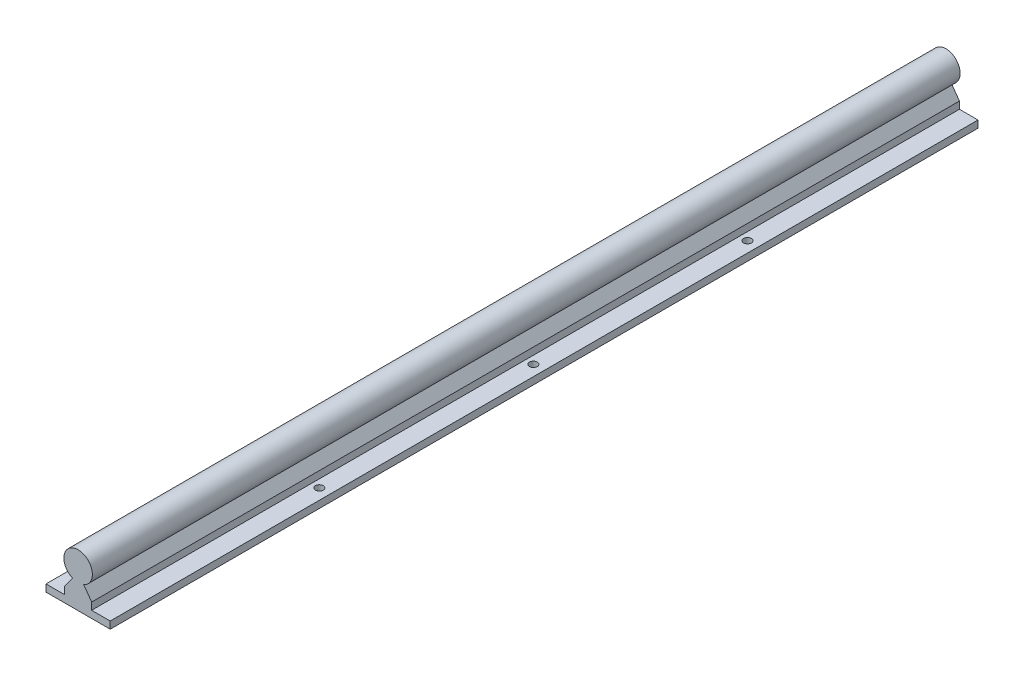
from build123d import *

# Parameters (mm, degrees)
SKETCH_1_R          = 10
EXTRUDE_1_DEPTH     = 608
SKETCH_2_R          = 2.75
CUT_EXTRUDE_2_DEPTH = 450


with BuildPart() as part:
    # 草图1 → 凸台-拉伸1 (new body)
    with BuildSketch(Plane.XY):
        with Locations((0, 27)):
            Circle(SKETCH_1_R)
        with BuildLine():
            Line((-22.5, 5), (-22.5, 0))
            Line((-22.5, 0), (0, 0))
            Line((0, 0), (0, 17))
            ThreePointArc((0, 17), (-1.870828693, 17.176558648), (-3.67559519, 17.7))
            Line((-3.67559519, 17.7), (-4, 17.7))
            Line((-4, 17.7), (-9.5, 10))
            Line((-9.5, 10), (-9.5, 5))
            Line((-9.5, 5), (-22.5, 5))
        make_face()
        with BuildLine():
            Line((0, 17), (0, 0))
            Line((0, 0), (22.5, 0))
            Line((22.5, 0), (22.5, 5))
            Line((22.5, 5), (9.5, 5))
            Line((9.5, 5), (9.5, 10))
            Line((9.5, 10), (4, 17.7))
            Line((4, 17.7), (3.67559519, 17.7))
            ThreePointArc((3.67559519, 17.7), (1.870828693, 17.176558648), (0, 17))
        make_face()
    extrude(amount=EXTRUDE_1_DEPTH)

    # 草图2 → 切除-拉伸2 (cut)
    with BuildSketch(Plane(origin=(0, 0, 0), x_dir=(1, 0, 0), z_dir=(0, 1, 0))):
        with Locations((15, -304)):
            Circle(SKETCH_2_R)
        with Locations((15, -454)):
            Circle(SKETCH_2_R)
        with Locations(Location((-15, -304, 0), (0, 0, 180))):
            Circle(SKETCH_2_R)
        with Locations(Location((-15, -454, 0), (0, 0, 180))):
            Circle(SKETCH_2_R)
        with Locations((15, -154)):
            Circle(SKETCH_2_R)
        with Locations(Location((-15, -154, 0), (0, 0, 180))):
            Circle(SKETCH_2_R)
    extrude(amount=CUT_EXTRUDE_2_DEPTH, mode=Mode.SUBTRACT)


solid = part.part
